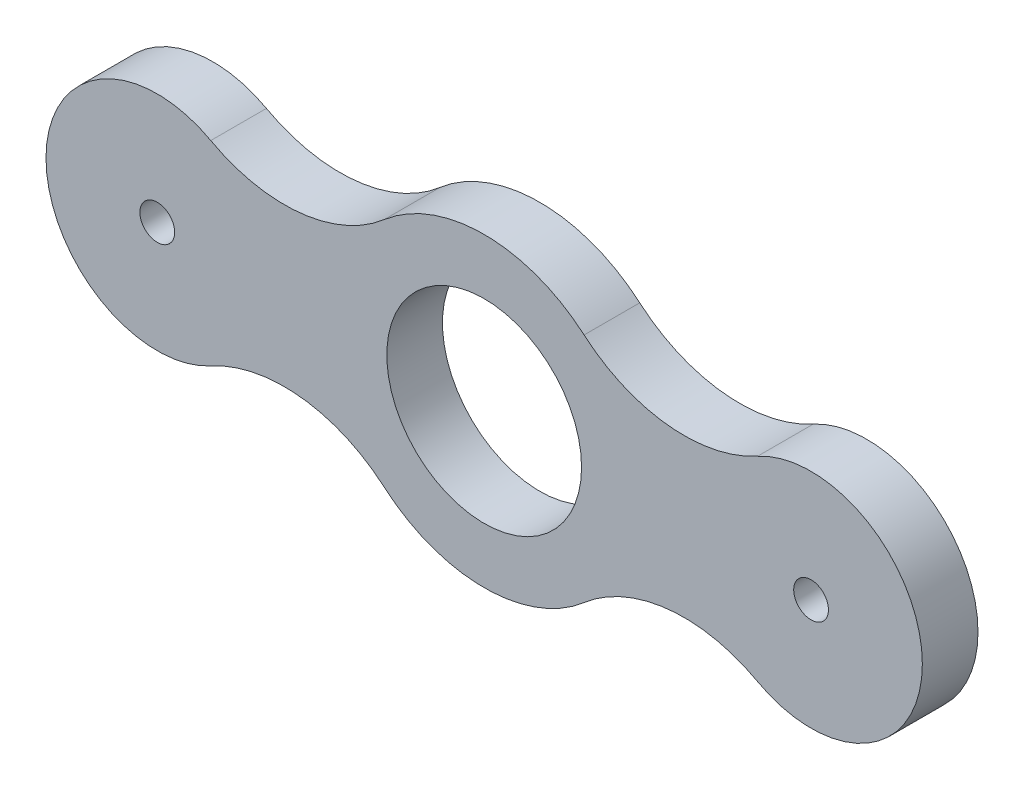
from build123d import *

# Parameters (mm, degrees)
SKETCH1_R           = 0.625
SKETCH1_R_2         = 3.5
BOSS_EXTRUDE1_DEPTH = 2


with BuildPart() as part:
    # Sketch1 → Boss-Extrude1 (new body)
    with BuildSketch(Plane.XY):
        with BuildLine():
            ThreePointArc((-9.827267637, 3.507577549), (-15.75, 0), (-9.827267637, -3.507577549))
            ThreePointArc((-9.827267637, -3.507577549), (-6.606615569, -2.860835621), (-3.591755319, -4.165248339))
            ThreePointArc((-3.591755319, -4.165248339), (0, -5.5), (3.591755319, -4.165248339))
            ThreePointArc((3.591755319, -4.165248339), (6.606615569, -2.860835621), (9.827267637, -3.507577549))
            ThreePointArc((9.827267637, -3.507577549), (15.75, 0), (9.827267637, 3.507577549))
            ThreePointArc((9.827267637, 3.507577549), (6.606615569, 2.860835621), (3.591755319, 4.165248339))
            ThreePointArc((3.591755319, 4.165248339), (0, 5.5), (-3.591755319, 4.165248339))
            ThreePointArc((-3.591755319, 4.165248339), (-6.606615569, 2.860835621), (-9.827267637, 3.507577549))
        make_face()
        with Locations((-11.75, 0)):
            Circle(SKETCH1_R, mode=Mode.SUBTRACT)
        Circle(SKETCH1_R_2, mode=Mode.SUBTRACT)
        with Locations(Location((11.75, 0, 0), (0, 0, 180))):
            Circle(SKETCH1_R, mode=Mode.SUBTRACT)
    extrude(amount=BOSS_EXTRUDE1_DEPTH)


solid = part.part
